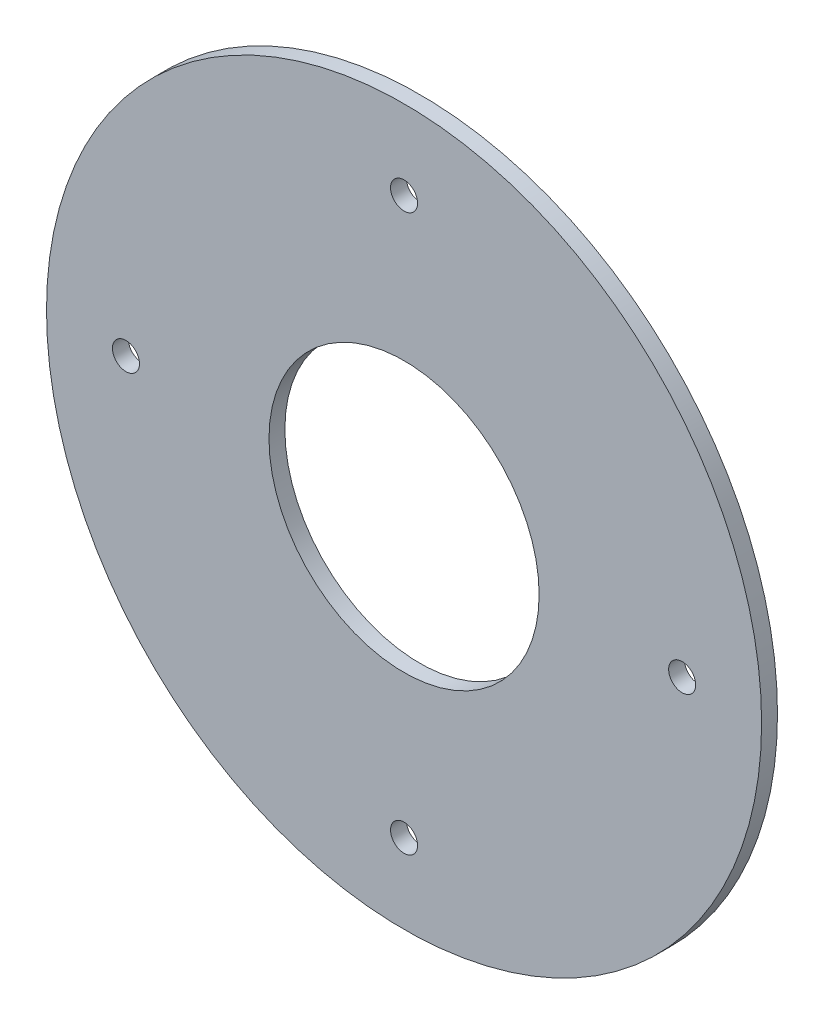
from build123d import *

# Parameters (mm, degrees)
SKETCH_1_R        = 45
SKETCH_1_R_2      = 17
EXTRUDE_1_DEPTH   = 2
HOLE_WIZARD_M31_D = 3.4


with BuildPart() as part:
    # Эскиз1 → Бобышка-Вытянуть1 (new body)
    with BuildSketch(Plane.XY):
        Circle(SKETCH_1_R)
        Circle(SKETCH_1_R_2, mode=Mode.SUBTRACT)
    extrude(amount=EXTRUDE_1_DEPTH)

    # Отверстие с зазором M31 (through all)
    with Locations(Plane.XY.offset(2)):
        with Locations((0, 35), (-35, 0), (0, -35), (35, 0)):
            Hole(HOLE_WIZARD_M31_D / 2)


solid = part.part
